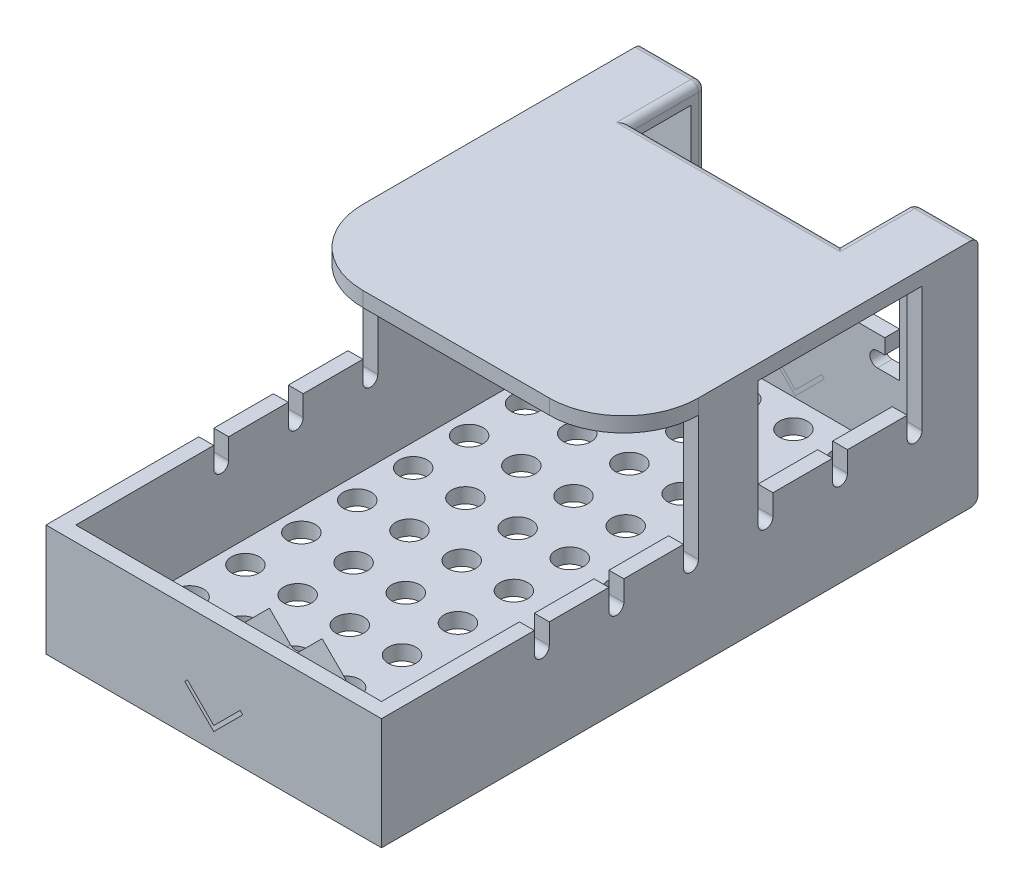
from build123d import *

# Parameters (mm, degrees)
SKETCH1_W                      = 114.3
SKETCH1_H                      = 38.1
BOSS_EXTRUDE1_DEPTH            = 203.2
SHELL1_T                       = -5.08
CUT_EXTRUDE1_REACH             = 216.495
SKETCH3_W                      = 170.18
SKETCH3_H                      = 33.02
CUT_EXTRUDE1_DIRECTION_2_REACH = 216.495
BOSS_EXTRUDE2_DEPTH            = 2.54
CUT_EXTRUDE2_DEPTH             = 237.233655519
CUT_EXTRUDE2_DEPTH_BACK        = 237.233655519
CUT_EXTRUDE3_DEPTH             = 214.650843434
CUT_EXTRUDE3_DEPTH_BACK        = 214.650843434
SKETCH6_R                      = 4.7625
FILLET1_R                      = 2.54
BOSS_EXTRUDE3_START            = -5.08
BOSS_EXTRUDE3_DEPTH            = 5.08
CUT_EXTRUDE4_DEPTH             = 5.08
SKETCH10_W                     = 5.08
SKETCH10_H                     = 20.32
BOSS_EXTRUDE4_DEPTH            = 35.56
BOSS_EXTRUDE5_DEPTH            = 25.4
BOSS_EXTRUDE5_DEPTH_BACK       = 95.25
SKETCH11_W                     = 114.3
SKETCH11_H                     = 5.08
FILLET2_R                      = 2.54
SKETCH12_W                     = 71.12
SKETCH12_H                     = 25.4
CUT_EXTRUDE5_DEPTH             = 5.08
FILLET3_R                      = 2.54
FILLET4_R                      = 25.4


with BuildPart() as part:
    # Sketch1 → Boss-Extrude1 (new body)
    with BuildSketch(Plane.XY):
        with Locations((0, 19.05)):
            Rectangle(SKETCH1_W, SKETCH1_H)
        Polygon((0, 7.511051224), (-8.980256121, 16.491307345), (-9.878281733, 15.593281733), (0, 5.715), (9.878281733, 15.593281733), (8.980256121, 16.491307345), align=None, mode=Mode.SUBTRACT)
    extrude(amount=-BOSS_EXTRUDE1_DEPTH)

    # Shell1
    shell1_openings = [part.faces().sort_by_distance(p)[0] for p in [
        (0, 38.1, -101.6),
    ]]
    offset(amount=SHELL1_T, openings=shell1_openings, kind=Kind.INTERSECTION)

    # Sketch3 → Cut-Extrude1 (cut, up to next)
    with BuildSketch(Plane(origin=(0, 0, 0), x_dir=(0, 0, -1), z_dir=(1, 0, 0)), mode=Mode.PRIVATE) as cut_extrude1_sk1:
        with Locations((113.03, 21.59)):
            Rectangle(SKETCH3_W, SKETCH3_H)
    cut_extrude1_tool1 = extrude(cut_extrude1_sk1.sketch, amount=-CUT_EXTRUDE1_REACH, mode=Mode.PRIVATE) & part.part
    add(cut_extrude1_tool1.solids().sort_by_distance((0, 21.59, -113.03))[0], mode=Mode.SUBTRACT)

    # Sketch3 → Cut-Extrude1 direction 2 (cut, up to next)
    with BuildSketch(Plane(origin=(0, 0, 0), x_dir=(0, 0, -1), z_dir=(1, 0, 0)), mode=Mode.PRIVATE) as cut_extrude1_direction_2_sk1:
        with Locations((113.03, 21.59)):
            Rectangle(SKETCH3_W, SKETCH3_H)
    cut_extrude1_direction_2_tool1 = extrude(cut_extrude1_direction_2_sk1.sketch, amount=CUT_EXTRUDE1_DIRECTION_2_REACH, mode=Mode.PRIVATE) & part.part
    add(cut_extrude1_direction_2_tool1.solids().sort_by_distance((0, 21.59, -113.03))[0], mode=Mode.SUBTRACT)

    # Sketch4 → Boss-Extrude2 (add)
    with BuildSketch(Plane(origin=(0, 0, -27.94), x_dir=(-1, 0, 0), z_dir=(0, 0, -1))):
        Polygon((0, 5.715), (-9.878281733, 15.593281733), (-8.980256121, 16.491307345), (0, 7.511051224), (8.980256121, 16.491307345), (9.878281733, 15.593281733), align=None)
    extrude(amount=-BOSS_EXTRUDE2_DEPTH)

    # Sketch5 → Cut-Extrude2 (cut, two sides: drawn at the far end of the back side and taken through both)
    with BuildSketch(Plane.ZY.offset(57.15).offset(-CUT_EXTRUDE2_DEPTH_BACK)):
        with BuildLine():
            Line((-184.15, 38.1), (-179.07, 38.1))
            Line((-179.07, 38.1), (-179.07, 31.115))
            ThreePointArc((-179.07, 31.115), (-181.61, 28.575), (-184.15, 31.115))
            Line((-184.15, 31.115), (-184.15, 38.1))
        make_face()
        with BuildLine():
            Line((-153.67, 38.1), (-153.67, 31.115))
            ThreePointArc((-153.67, 31.115), (-156.21, 28.575), (-158.75, 31.115))
            Line((-158.75, 31.115), (-158.75, 38.1))
            Line((-158.75, 38.1), (-153.67, 38.1))
        make_face()
        with BuildLine():
            Line((-128.27, 38.1), (-128.27, 31.115))
            ThreePointArc((-128.27, 31.115), (-130.81, 28.575), (-133.35, 31.115))
            Line((-133.35, 31.115), (-133.35, 38.1))
            Line((-133.35, 38.1), (-128.27, 38.1))
        make_face()
        with BuildLine():
            Line((-102.87, 38.1), (-102.87, 31.115))
            ThreePointArc((-102.87, 31.115), (-105.41, 28.575), (-107.95, 31.115))
            Line((-107.95, 31.115), (-107.95, 38.1))
            Line((-107.95, 38.1), (-102.87, 38.1))
        make_face()
        with BuildLine():
            Line((-77.47, 38.1), (-77.47, 31.115))
            ThreePointArc((-77.47, 31.115), (-80.01, 28.575), (-82.55, 31.115))
            Line((-82.55, 31.115), (-82.55, 38.1))
            Line((-82.55, 38.1), (-77.47, 38.1))
        make_face()
        with BuildLine():
            Line((-52.07, 38.1), (-52.07, 31.115))
            ThreePointArc((-52.07, 31.115), (-54.61, 28.575), (-57.15, 31.115))
            Line((-57.15, 31.115), (-57.15, 38.1))
            Line((-57.15, 38.1), (-52.07, 38.1))
        make_face()
    extrude(amount=CUT_EXTRUDE2_DEPTH + CUT_EXTRUDE2_DEPTH_BACK, mode=Mode.SUBTRACT)

    # Sketch6 → Cut-Extrude3 (cut, two sides: drawn at the far end of the back side and taken through both)
    with BuildSketch(Plane(origin=(0, 5.08, 0), x_dir=(1, 0, 0), z_dir=(0, 1, 0)).offset(-CUT_EXTRUDE3_DEPTH_BACK)):
        with Locations(Location((-44.45, 188.595, 0), (0, 0, 180))):
            Circle(SKETCH6_R)
        with Locations(Location((-26.67, 188.595, 0), (0, 0, 180))):
            Circle(SKETCH6_R)
        with Locations(Location((-8.89, 188.595, 0), (0, 0, 180))):
            Circle(SKETCH6_R)
        with Locations(Location((8.89, 188.595, 0), (0, 0, 180))):
            Circle(SKETCH6_R)
        with Locations(Location((26.67, 188.595, 0), (0, 0, 180))):
            Circle(SKETCH6_R)
        with Locations(Location((44.45, 188.595, 0), (0, 0, 180))):
            Circle(SKETCH6_R)
        with Locations(Location((-26.67, 169.545, 0), (0, 0, 180))):
            Circle(SKETCH6_R)
        with Locations(Location((-8.89, 169.545, 0), (0, 0, 180))):
            Circle(SKETCH6_R)
        with Locations(Location((8.89, 169.545, 0), (0, 0, 180))):
            Circle(SKETCH6_R)
        with Locations(Location((26.67, 169.545, 0), (0, 0, 180))):
            Circle(SKETCH6_R)
        with Locations(Location((44.45, 169.545, 0), (0, 0, 180))):
            Circle(SKETCH6_R)
        with Locations(Location((-26.67, 150.495, 0), (0, 0, 180))):
            Circle(SKETCH6_R)
        with Locations(Location((-8.89, 150.495, 0), (0, 0, 180))):
            Circle(SKETCH6_R)
        with Locations(Location((8.89, 150.495, 0), (0, 0, 180))):
            Circle(SKETCH6_R)
        with Locations(Location((26.67, 150.495, 0), (0, 0, 180))):
            Circle(SKETCH6_R)
        with Locations(Location((44.45, 150.495, 0), (0, 0, 180))):
            Circle(SKETCH6_R)
        with Locations(Location((-26.67, 131.445, 0), (0, 0, 180))):
            Circle(SKETCH6_R)
        with Locations(Location((-8.89, 131.445, 0), (0, 0, 180))):
            Circle(SKETCH6_R)
        with Locations(Location((8.89, 131.445, 0), (0, 0, 180))):
            Circle(SKETCH6_R)
        with Locations(Location((26.67, 131.445, 0), (0, 0, 180))):
            Circle(SKETCH6_R)
        with Locations(Location((44.45, 131.445, 0), (0, 0, 180))):
            Circle(SKETCH6_R)
        with Locations(Location((-26.67, 112.395, 0), (0, 0, 180))):
            Circle(SKETCH6_R)
        with Locations(Location((-8.89, 112.395, 0), (0, 0, 180))):
            Circle(SKETCH6_R)
        with Locations(Location((8.89, 112.395, 0), (0, 0, 180))):
            Circle(SKETCH6_R)
        with Locations(Location((26.67, 112.395, 0), (0, 0, 180))):
            Circle(SKETCH6_R)
        with Locations(Location((44.45, 112.395, 0), (0, 0, 180))):
            Circle(SKETCH6_R)
        with Locations(Location((-26.67, 93.345, 0), (0, 0, 180))):
            Circle(SKETCH6_R)
        with Locations(Location((-8.89, 93.345, 0), (0, 0, 180))):
            Circle(SKETCH6_R)
        with Locations(Location((8.89, 93.345, 0), (0, 0, 180))):
            Circle(SKETCH6_R)
        with Locations(Location((26.67, 93.345, 0), (0, 0, 180))):
            Circle(SKETCH6_R)
        with Locations(Location((44.45, 93.345, 0), (0, 0, 180))):
            Circle(SKETCH6_R)
        with Locations(Location((-26.67, 74.295, 0), (0, 0, 180))):
            Circle(SKETCH6_R)
        with Locations(Location((-8.89, 74.295, 0), (0, 0, 180))):
            Circle(SKETCH6_R)
        with Locations(Location((8.89, 74.295, 0), (0, 0, 180))):
            Circle(SKETCH6_R)
        with Locations(Location((26.67, 74.295, 0), (0, 0, 180))):
            Circle(SKETCH6_R)
        with Locations(Location((44.45, 74.295, 0), (0, 0, 180))):
            Circle(SKETCH6_R)
        with Locations(Location((-26.67, 55.245, 0), (0, 0, 180))):
            Circle(SKETCH6_R)
        with Locations(Location((-8.89, 55.245, 0), (0, 0, 180))):
            Circle(SKETCH6_R)
        with Locations(Location((8.89, 55.245, 0), (0, 0, 180))):
            Circle(SKETCH6_R)
        with Locations(Location((26.67, 55.245, 0), (0, 0, 180))):
            Circle(SKETCH6_R)
        with Locations(Location((44.45, 55.245, 0), (0, 0, 180))):
            Circle(SKETCH6_R)
        with Locations(Location((-26.67, 36.195, 0), (0, 0, 180))):
            Circle(SKETCH6_R)
        with Locations(Location((-8.89, 36.195, 0), (0, 0, 180))):
            Circle(SKETCH6_R)
        with Locations(Location((8.89, 36.195, 0), (0, 0, 180))):
            Circle(SKETCH6_R)
        with Locations(Location((26.67, 36.195, 0), (0, 0, 180))):
            Circle(SKETCH6_R)
        with Locations(Location((44.45, 36.195, 0), (0, 0, 180))):
            Circle(SKETCH6_R)
        with Locations(Location((-44.45, 169.545, 0), (0, 0, 180))):
            Circle(SKETCH6_R)
        with Locations(Location((-44.45, 150.495, 0), (0, 0, 180))):
            Circle(SKETCH6_R)
        with Locations(Location((-44.45, 131.445, 0), (0, 0, 180))):
            Circle(SKETCH6_R)
        with Locations(Location((-44.45, 112.395, 0), (0, 0, 180))):
            Circle(SKETCH6_R)
        with Locations(Location((-44.45, 93.345, 0), (0, 0, 180))):
            Circle(SKETCH6_R)
        with Locations(Location((-44.45, 74.295, 0), (0, 0, 180))):
            Circle(SKETCH6_R)
        with Locations(Location((-44.45, 55.245, 0), (0, 0, 180))):
            Circle(SKETCH6_R)
        with Locations(Location((-44.45, 36.195, 0), (0, 0, 180))):
            Circle(SKETCH6_R)
    extrude(amount=CUT_EXTRUDE3_DEPTH + CUT_EXTRUDE3_DEPTH_BACK, mode=Mode.SUBTRACT)

    # Fillet1
    fillet1_edges = [part.edges().sort_by_distance(p)[0] for p in [
        (0, 14.695256121, -16.51),
        (-6.549204897, 5.08, -16.51),
        (6.549204897, 5.08, -16.51),
    ]]
    fillet(fillet1_edges, radius=FILLET1_R)

    # Sketch8 → Cut-Extrude4 (cut)
    with BuildSketch(Plane(origin=(0, 0, -203.2), x_dir=(-1, 0, 0), z_dir=(0, 0, -1))):
        with BuildLine():
            Line((-30.48, 38.1), (-30.48, 33.02))
            Line((-30.48, 33.02), (-27.94, 33.02))
            ThreePointArc((-27.94, 33.02), (-25.4, 30.48), (-27.94, 27.94))
            Line((-27.94, 27.94), (-35.56, 27.94))
            Line((-35.56, 27.94), (-35.56, 38.1))
            Line((-35.56, 38.1), (-30.48, 38.1))
        make_face()
        with BuildLine():
            Line((30.48, 33.02), (27.94, 33.02))
            ThreePointArc((27.94, 33.02), (25.4, 30.48), (27.94, 27.94))
            Line((27.94, 27.94), (35.56, 27.94))
            Line((35.56, 27.94), (35.56, 38.1))
            Line((35.56, 38.1), (30.48, 38.1))
            Line((30.48, 38.1), (30.48, 33.02))
        make_face()
    extrude(amount=-CUT_EXTRUDE4_DEPTH, mode=Mode.SUBTRACT)

    # Sketch10 → Boss-Extrude4 (add)
    with BuildSketch(Plane(origin=(0, 38.1, 0), x_dir=(1, 0, 0), z_dir=(0, 1, 0))):
        Polygon((35.56, 203.2), (35.56, 198.12), (52.07, 198.12), (52.07, 184.15), (57.15, 184.15), (57.15, 203.2), align=None)
        Polygon((-35.56, 198.12), (-35.56, 203.2), (-57.15, 203.2), (-57.15, 184.15), (-52.07, 184.15), (-52.07, 198.12), align=None)
        with Locations((-54.61, 118.11)):
            Rectangle(SKETCH10_W, SKETCH10_H)
        with Locations((54.61, 118.11)):
            Rectangle(SKETCH10_W, SKETCH10_H)
    extrude(amount=BOSS_EXTRUDE4_DEPTH)

    # Sketch11 → Boss-Extrude5 (add, two sides: drawn at the far end of the back side and taken through both)
    with BuildSketch(Plane.XY.offset(-107.95).offset(-BOSS_EXTRUDE5_DEPTH_BACK)):
        with Locations((0, 76.2)):
            Rectangle(SKETCH11_W, SKETCH11_H)
    extrude(amount=BOSS_EXTRUDE5_DEPTH + BOSS_EXTRUDE5_DEPTH_BACK)

    # Fillet2
    fillet2_edges = [part.edges().sort_by_distance(p)[0] for p in [
        (0, 78.74, -203.2),
        (0, 0, -203.2),
    ]]
    fillet(fillet2_edges, radius=FILLET2_R)

    # Sketch12 → Cut-Extrude5 (cut)
    with BuildSketch(Plane(origin=(0, 78.74, 0), x_dir=(1, 0, 0), z_dir=(0, 1, 0))):
        with Locations((0, 190.5)):
            Rectangle(SKETCH12_W, SKETCH12_H)
    extrude(amount=-CUT_EXTRUDE5_DEPTH, mode=Mode.SUBTRACT)

    # Fillet3
    fillet3_edges = [part.edges().sort_by_distance(p)[0] for p in [
        (35.56, 77.996051224, -202.456051224),
        (-35.56, 77.996051224, -202.456051224),
        (35.56, 78.74, -189.23),
        (-35.56, 78.74, -189.23),
        (0, 78.74, -177.8),
        (35.56, 52.07, -203.2),
        (-35.56, 52.07, -203.2),
    ]]
    fillet(fillet3_edges, radius=FILLET3_R)

    # Fillet4
    fillet4_edges = [part.edges().sort_by_distance(p)[0] for p in [
        (-57.15, 76.2, -82.55),
        (57.15, 76.2, -82.55),
    ]]
    fillet(fillet4_edges, radius=FILLET4_R)


with BuildPart() as body_2:
    # Sketch7 → Boss-Extrude3 (new body)
    with BuildSketch(Plane(origin=(0, 0, -203.2), x_dir=(-1, 0, 0), z_dir=(0, 0, -1)).offset(BOSS_EXTRUDE3_START)):
        Polygon((-8.980256121, 16.491307345), (0, 7.511051224), (8.980256121, 16.491307345), (9.878281733, 15.593281733), (0, 5.715), (-9.878281733, 15.593281733), align=None)
    extrude(amount=BOSS_EXTRUDE3_DEPTH)


solid = Compound([part.part, body_2.part])
